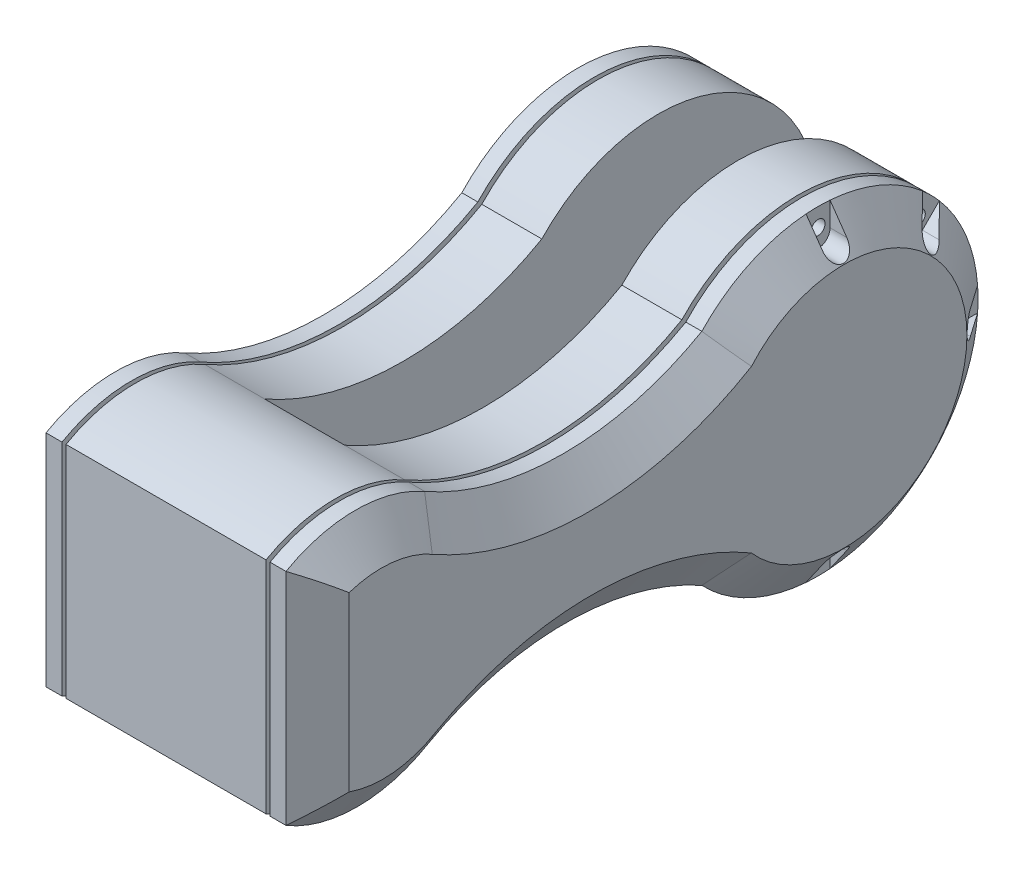
from build123d import *

# Parameters (mm, degrees)
SKETCH1_W                       = 27.5
SKETCH1_H                       = 7.410394244
BOSS_EXTRUDE1_DEPTH             = 1
BOSS_EXTRUDE3_DEPTH             = 15
BOSS_EXTRUDE4_DEPTH             = 1
BOSS_EXTRUDE5_DEPTH             = 4
BOSS_EXTRUDE6_DEPTH             = 6.5
BOSS_EXTRUDE6_DRAFT             = 55
CUT_EXTRUDE1_DEPTH              = 6.5
SKETCH8_R                       = 1.75
CUT_EXTRUDE2_DEPTH              = 5
CIRPATTERN1_COUNT               = 3
CIRPATTERN1_ANGLE               = 90
CIRPATTERN1_THE_OTHER_WAY_COUNT = 3
CIRPATTERN1_THE_OTHER_WAY_ANGLE = 90
BOSS_EXTRUDE7_DEPTH             = 20


with BuildPart() as part:
    # Sketch1 → Boss-Extrude1 (new body)
    with BuildSketch(Plane.XY):
        with Locations((13.75, 3.705197122)):
            Rectangle(SKETCH1_W, SKETCH1_H)
    extrude(amount=BOSS_EXTRUDE1_DEPTH)



with BuildPart() as body_2:
    # Sketch2 → Boss-Extrude3 (new body)
    with BuildSketch(Plane(origin=(27.5, 0, 0), x_dir=(0, 0, -1), z_dir=(1, 0, 0))):
        with BuildLine():
            Line((-1, 27.5), (-1, -27.5))
            ThreePointArc((-1, -27.5), (16.825437484, -32.379346313), (34.650874968, -27.5))
            ThreePointArc((34.650874968, -27.5), (68.801749936, -18.604154842), (102.952624903, -27.5))
            ThreePointArc((102.952624903, -27.5), (172, 0), (102.952624903, 27.5))
            ThreePointArc((102.952624903, 27.5), (68.301749936, 18.3220097), (33.650874968, 27.5))
            ThreePointArc((33.650874968, 27.5), (16.325437484, 32.08899515), (-1, 27.5))
        make_face()
    extrude(amount=BOSS_EXTRUDE3_DEPTH)

    # Sketch3 → Boss-Extrude4 (add)
    with BuildSketch(Plane(origin=(42.5, 0, 0), x_dir=(0, 0, -1), z_dir=(1, 0, 0))):
        with BuildLine():
            Line((1.5, 26.010551184), (1.5, -26.039091007))
            ThreePointArc((1.5, -26.039091007), (17.544347497, -29.871394085), (33.403491773, -25.333203221))
            ThreePointArc((33.403491773, -25.333203221), (68.981569395, -16.104377842), (104.513429496, -25.509575495))
            ThreePointArc((104.513429496, -25.509575495), (169.499999651, -0.005114332), (104.520388622, 25.517071903))
            ThreePointArc((104.520388622, 25.517071903), (68.492067352, 15.822259499), (32.413343719, 25.327785368))
            ThreePointArc((32.413343719, 25.327785368), (17.04307188, 29.58107112), (1.5, 26.010551184))
        make_face()
    extrude(amount=BOSS_EXTRUDE4_DEPTH)

    # Sketch4 → Boss-Extrude5 (add)
    with BuildSketch(Plane(origin=(43.5, 0, 0), x_dir=(0, 0, -1), z_dir=(1, 0, 0))):
        with BuildLine():
            Line((-1, 27.5), (-1, -27.5))
            ThreePointArc((-1, -27.5), (16.825437484, -32.379346313), (34.650874968, -27.5))
            ThreePointArc((34.650874968, -27.5), (68.801749936, -18.604154842), (102.952624903, -27.5))
            ThreePointArc((102.952624903, -27.5), (172, 0), (102.952624903, 27.5))
            ThreePointArc((102.952624903, 27.5), (68.301749936, 18.3220097), (33.650874968, 27.5))
            ThreePointArc((33.650874968, 27.5), (16.325437484, 32.08899515), (-1, 27.5))
        make_face()
    extrude(amount=BOSS_EXTRUDE5_DEPTH)


with BuildPart() as boss_extrude6_tool:
    # Sketch5 → Boss-Extrude6 (with draft: the straight prism first)
    with BuildSketch(Plane(origin=(47.5, 0, 0), x_dir=(0, 0, -1), z_dir=(1, 0, 0))):
        with BuildLine():
            Line((-1, 27.5), (-1, -27.5))
            ThreePointArc((-1, -27.5), (16.825437484, -32.379346313), (34.650874968, -27.5))
            ThreePointArc((34.650874968, -27.5), (68.801749936, -18.604154842), (102.952624903, -27.5))
            ThreePointArc((102.952624903, -27.5), (172, 0), (102.952624903, 27.5))
            ThreePointArc((102.952624903, 27.5), (68.301749936, 18.3220097), (33.650874968, 27.5))
            ThreePointArc((33.650874968, 27.5), (16.325437484, 32.08899515), (-1, 27.5))
        make_face()
    extrude(amount=BOSS_EXTRUDE6_DEPTH)
    # Boss-Extrude6: the draft: its side faces are tilted about the plane it starts from
    boss_extrude6_sides = [boss_extrude6_tool.faces().sort_by_distance(p)[0] for p in [
        (50.75, 32.08899515, -16.325437484),
        (50.75, 0, 1),
        (50.75, -32.379346313, -16.825437484),
        (50.75, -18.604154842, -68.801749936),
        (50.75, 0, -172),
        (50.75, 18.3220097, -68.301749936),
    ]]
    draft(boss_extrude6_sides, Plane(origin=(47.5, 0, 0), x_dir=(0, 0, -1), z_dir=(1, 0, 0)), BOSS_EXTRUDE6_DRAFT)


with BuildPart() as body_2_1:
    add(body_2.part)

    # Boss-Extrude6: add boss_extrude6_tool
    add(boss_extrude6_tool.part)

    # Sketch6 → Cut-Extrude1 (cut)
    with BuildSketch(Plane(origin=(54, 0, 0), x_dir=(0, 0, -1), z_dir=(1, 0, 0))):
        with BuildLine():
            Line((171.88734135, 3), (165.88734135, 3))
            ThreePointArc((165.88734135, 3), (162.88734135, 0), (165.88734135, -3))
            Line((165.88734135, -3), (171.88734135, -3))
            ThreePointArc((171.88734135, -3), (172.88734135, 0), (171.88734135, 3))
        make_face()
    cut_extrude1 = extrude(amount=-CUT_EXTRUDE1_DEPTH, mode=Mode.SUBTRACT)

    # Sketch8 → Cut-Extrude2 (cut)
    with BuildSketch(Plane(origin=(47.5, 0, 0), x_dir=(0, 0, -1), z_dir=(1, 0, 0))):
        with Locations((167.443670675, 0)):
            Circle(SKETCH8_R)
    cut_extrude2 = extrude(amount=-CUT_EXTRUDE2_DEPTH, mode=Mode.SUBTRACT)

    # CirPattern1: Cut-Extrude1, Cut-Extrude2 ×3 about axis
    cirpattern1_axis = Axis((0, 0, -132), (1, 0, 0))
    add([cut_extrude1.rotate(cirpattern1_axis, i * CIRPATTERN1_ANGLE / (CIRPATTERN1_COUNT - 1)) for i in range(1, CIRPATTERN1_COUNT)], mode=Mode.SUBTRACT)
    add([cut_extrude2.rotate(cirpattern1_axis, i * CIRPATTERN1_ANGLE / (CIRPATTERN1_COUNT - 1)) for i in range(1, CIRPATTERN1_COUNT)], mode=Mode.SUBTRACT)

    # CirPattern1 the other way: Cut-Extrude1, Cut-Extrude2 ×3 about axis
    cirpattern1_the_other_way_axis = Axis((0, 0, -132), (-1, 0, 0))
    add([cut_extrude1.rotate(cirpattern1_the_other_way_axis, i * CIRPATTERN1_THE_OTHER_WAY_ANGLE / (CIRPATTERN1_THE_OTHER_WAY_COUNT - 1)) for i in range(1, CIRPATTERN1_THE_OTHER_WAY_COUNT)], mode=Mode.SUBTRACT)
    add([cut_extrude2.rotate(cirpattern1_the_other_way_axis, i * CIRPATTERN1_THE_OTHER_WAY_ANGLE / (CIRPATTERN1_THE_OTHER_WAY_COUNT - 1)) for i in range(1, CIRPATTERN1_THE_OTHER_WAY_COUNT)], mode=Mode.SUBTRACT)


with BuildPart() as part_1:
    add(part.part)

    add(body_2_1.part)  # Boss-Extrude7 merges body 2
    # Sketch9 → Boss-Extrude7 (add)
    with BuildSketch(Plane.ZY.offset(-27.5)):
        with BuildLine():
            Line((-33.650874968, 27.5), (-34.650874968, -27.5))
            ThreePointArc((-34.650874968, -27.5), (-16.825437484, -32.379346313), (1, -27.5))
            Line((1, -27.5), (1, 27.5))
            ThreePointArc((1, 27.5), (-16.325437484, 32.08899515), (-33.650874968, 27.5))
        make_face()
    extrude(amount=BOSS_EXTRUDE7_DEPTH)

    # Mirror2: part across plane


with BuildPart() as part_2:
    add(part_1.part)
    add(part_1.part.mirror(Plane.ZY.offset(-17.5)))


solid = part_2.part
